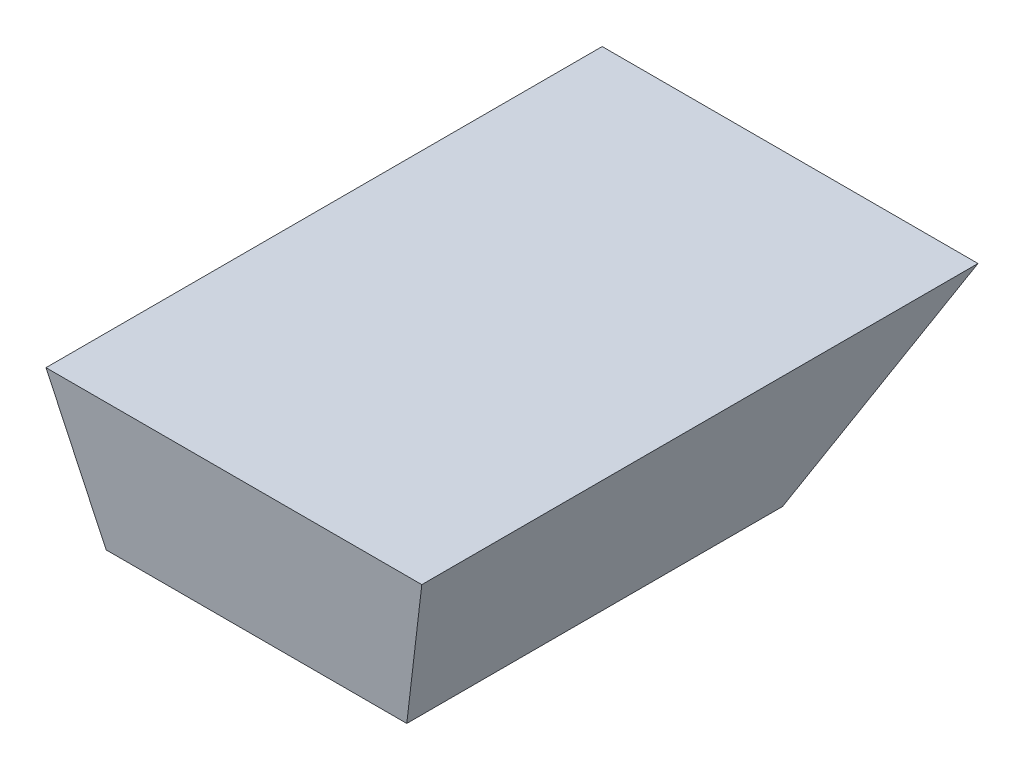
from build123d import *

# Parameters (mm, degrees)
SKETCH_1_W          = 250
SKETCH_1_H          = 100
EXTRUDE_1_DEPTH     = 370
CUT_EXTRUDE_1_DEPTH = 370
CUT_EXTRUDE_3_DEPTH = 458.602447546


with BuildPart() as part:
    # 草圖1 → 填料-伸長1 (new body)
    with BuildSketch(Plane.XY):
        Rectangle(SKETCH_1_W, SKETCH_1_H)
    extrude(amount=EXTRUDE_1_DEPTH)

    # 草圖2 → 除料-伸長1 (cut)
    with BuildSketch(Plane.XY.offset(370)):
        Polygon((-125, 50), (-100, -50), (-125, -50), align=None)
        Polygon((125, 50), (125, -50), (100, -50), align=None)
    extrude(amount=-CUT_EXTRUDE_1_DEPTH, mode=Mode.SUBTRACT)

    # 草圖7 → 除料-伸長3 (cut, through all)
    with BuildSketch(Plane(origin=(-125, 50, 370), x_dir=(0, 0, 1), z_dir=(-1, 0, 0))):
        Polygon((0, 0), (-15, -100), (0, -100), align=None)
        Polygon((-370, 0), (-265, -100), (-370, -100), align=None)
    extrude(amount=-CUT_EXTRUDE_3_DEPTH, mode=Mode.SUBTRACT)


solid = part.part
